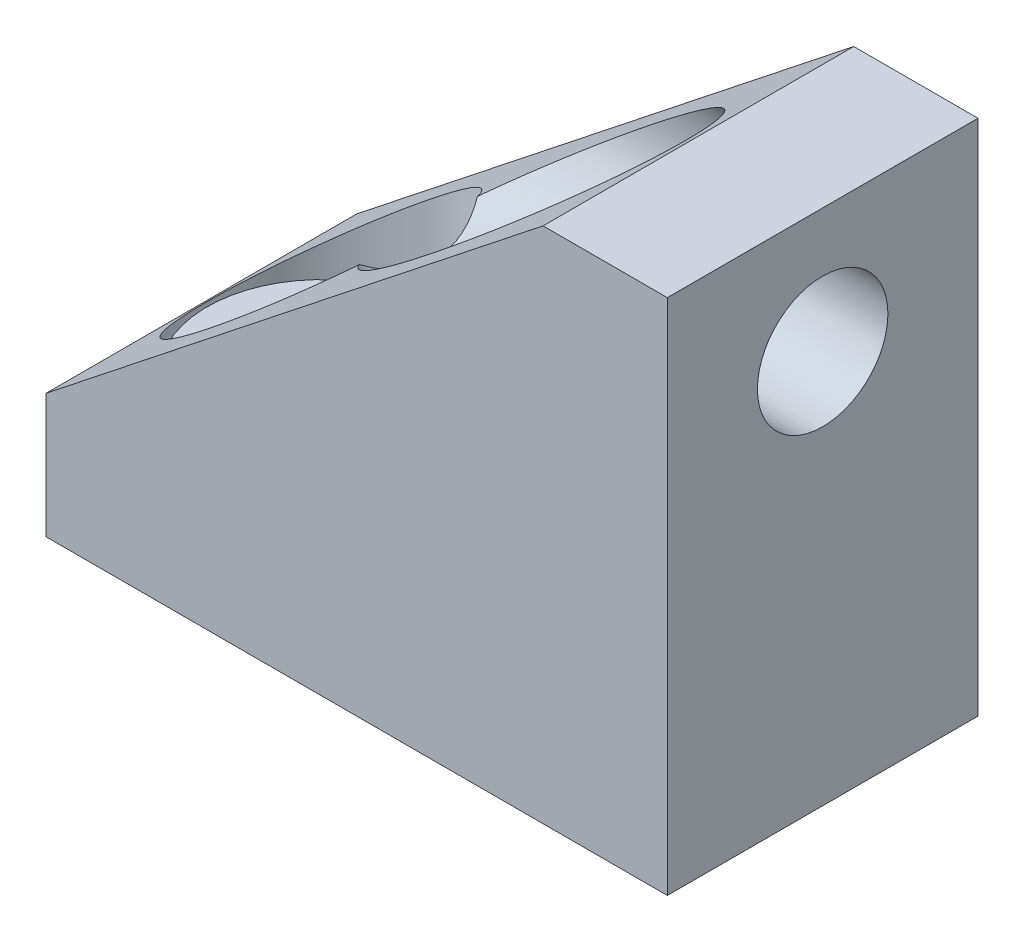
from build123d import *

# Parameters (mm, degrees)
BOSS_EXTRUDE2_DEPTH = 15
SKETCH4_R           = 3.15
CUT_EXTRUDE1_DEPTH  = 46.776415929
SKETCH4_3_R         = 5.5
SKETCH4_3_R_2       = 3.15
CUT_EXTRUDE2_DEPTH  = 14
SKETCH6_R           = 3.15
CUT_EXTRUDE3_DEPTH  = 49.171363436
SKETCH6_3_R         = 5.5
SKETCH6_3_R_2       = 3.15
CUT_EXTRUDE4_DEPTH  = 32.34684153


with BuildPart() as part:
    # Sketch3 → Boss-Extrude2 (new body)
    with BuildSketch(Plane.XY):
        Polygon((8.34684153, 0), (38.34684153, 0), (38.34684153, 25), (32.34684153, 25), (8.34684153, 6), align=None)
    extrude(amount=BOSS_EXTRUDE2_DEPTH)

    # Sketch4 → Cut-Extrude1 (cut, through all)
    with BuildSketch(Plane(origin=(0, 20, 0), x_dir=(1, 0, 0), z_dir=(0, 1, 0))):
        with Locations(Location((14.12083253, -7.5, 0), (0, 0, 270))):
            Circle(SKETCH4_R)
    extrude(amount=-CUT_EXTRUDE1_DEPTH, mode=Mode.SUBTRACT)

    # Sketch4<3> → Cut-Extrude2 (cut)
    with BuildSketch(Plane(origin=(0, 20, 0), x_dir=(1, 0, 0), z_dir=(0, 1, 0))):
        with Locations(Location((14.12083253, -7.5, 0), (0, 0, 270))):
            Circle(SKETCH4_3_R)
        with Locations(Location((14.12083253, -7.5, 0), (0, 0, 270))):
            Circle(SKETCH4_3_R_2, mode=Mode.SUBTRACT)
    extrude(amount=-CUT_EXTRUDE2_DEPTH, mode=Mode.SUBTRACT)

    # Sketch6 → Cut-Extrude3 (cut, through all)
    with BuildSketch(Plane(origin=(0, 0, 0), x_dir=(0, 0, -1), z_dir=(1, 0, 0))):
        with Locations(Location((-7.5, 19, 0), (0, 0, 270))):
            Circle(SKETCH6_R)
    extrude(amount=CUT_EXTRUDE3_DEPTH, mode=Mode.SUBTRACT)

    # Sketch6<3> → Cut-Extrude4 (cut)
    with BuildSketch(Plane(origin=(0, 0, 0), x_dir=(0, 0, -1), z_dir=(1, 0, 0))):
        with Locations(Location((-7.5, 19, 0), (0, 0, 180))):
            Circle(SKETCH6_3_R)
        with Locations(Location((-7.5, 19, 0), (0, 0, 180))):
            Circle(SKETCH6_3_R_2, mode=Mode.SUBTRACT)
    extrude(amount=CUT_EXTRUDE4_DEPTH, mode=Mode.SUBTRACT)


solid = part.part
